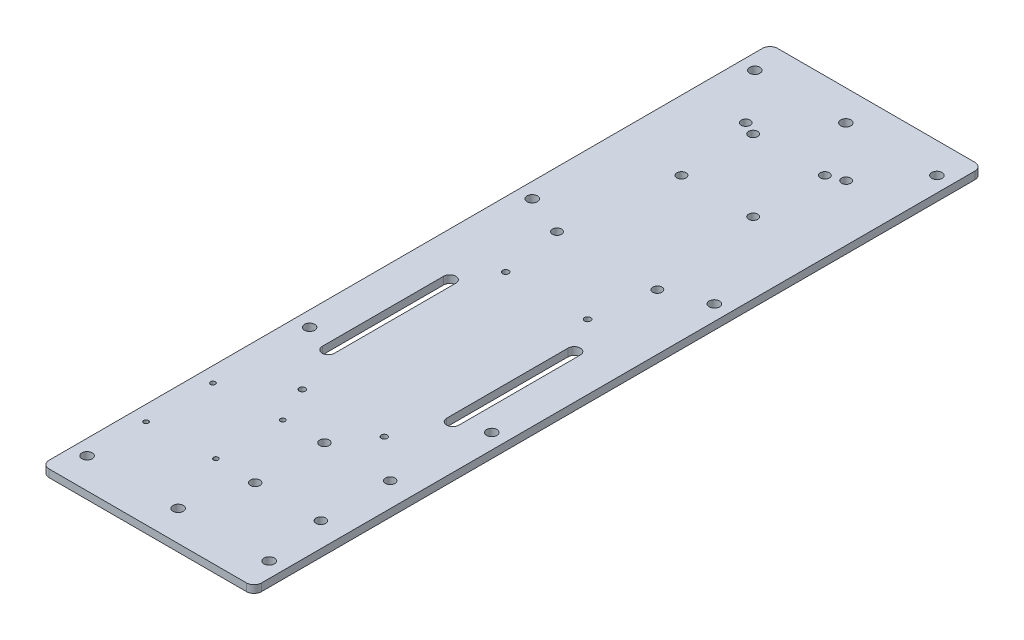
from build123d import *

# Parameters (mm, degrees)
PLATE_THICKNESS_DEPTH        = 3.175
SKETCH3_R                    = 2.159
MOUNTING_HOLES_DEPTH         = 159.781746826
SKETCH4_R                    = 1.905
JETSON_HOLES_W_O_MOUNT_DEPTH = 159.781746826
SKETCH5_R                    = 1.905
PDB_HOLES_DEPTH              = 159.781746826
SKETCH7_R                    = 1.27
PIXHAWK_HOLES_DEPTH          = 159.781746826
BATTERY_HOLES_DEPTH          = 159.781746826
SKETCH9_R                    = 2
CUT_EXTRUDE1_DEPTH           = 159.781746826
VENTRAL_CAMERA_HOLES_REACH   = 160.782
SKETCH10_R                   = 1


with BuildPart() as part:
    # Sketch2 → Plate Thickness (new body)
    with BuildSketch(Plane(origin=(0, 0, 0), x_dir=(1, 0, 0), z_dir=(0, 1, 0))):
        with BuildLine():
            Line((-41.275, 152.4), (41.275, 152.4))
            ThreePointArc((41.275, 152.4), (43.52006403, 151.47006403), (44.45, 149.225))
            Line((44.45, 149.225), (44.45, -149.225))
            ThreePointArc((44.45, -149.225), (43.52006403, -151.47006403), (41.275, -152.4))
            Line((41.275, -152.4), (-41.275, -152.4))
            ThreePointArc((-41.275, -152.4), (-43.52006403, -151.47006403), (-44.45, -149.225))
            Line((-44.45, -149.225), (-44.45, 149.225))
            ThreePointArc((-44.45, 149.225), (-43.52006403, 151.47006403), (-41.275, 152.4))
        make_face()
    extrude(amount=PLATE_THICKNESS_DEPTH)

    # Sketch3 → Mounting holes (cut, through all)
    with BuildSketch(Plane(origin=(0, 3.175, 0), x_dir=(1, 0, 0), z_dir=(0, 1, 0))):
        with Locations(Location((-38.1, 139.7, 0), (0, 0, 270))):
            Circle(SKETCH3_R)
        with Locations(Location((-38.1, 46.566666666, 0), (0, 0, 270))):
            Circle(SKETCH3_R)
        with Locations(Location((-38.1, -46.56666582, 0), (0, 0, 90))):
            Circle(SKETCH3_R)
        with Locations(Location((-38.1, -139.7, 0), (0, 0, 90))):
            Circle(SKETCH3_R)
        with Locations(Location((38.1, -139.7, 0), (0, 0, 270))):
            Circle(SKETCH3_R)
        with Locations(Location((38.1, -46.56666582, 0), (0, 0, 270))):
            Circle(SKETCH3_R)
        with Locations(Location((38.1, 46.566666666, 0), (0, 0, 90))):
            Circle(SKETCH3_R)
        with Locations(Location((38.1, 139.7, 0), (0, 0, 90))):
            Circle(SKETCH3_R)
        with Locations(Location((0, 139.7, 0), (0, 0, 270))):
            Circle(SKETCH3_R)
        with Locations(Location((0, -139.7, 0), (0, 0, 90))):
            Circle(SKETCH3_R)
    extrude(amount=-MOUNTING_HOLES_DEPTH, mode=Mode.SUBTRACT)

    # Sketch4 → Jetson Holes (w/o mount) (cut, through all)
    with BuildSketch(Plane(origin=(0, 3.175, 0), x_dir=(1, 0, 0), z_dir=(0, 1, 0))):
        with Locations(Location((-21.0058, 118.808268359, 0), (0, 0, 270))):
            Circle(SKETCH4_R)
        with Locations(Location((-21.0058, 39.814268359, 0), (0, 0, 270))):
            Circle(SKETCH4_R)
        with Locations(Location((21.0058, 39.814268359, 0), (0, 0, 90))):
            Circle(SKETCH4_R)
        with Locations(Location((21.0058, 118.808268359, 0), (0, 0, 90))):
            Circle(SKETCH4_R)
    extrude(amount=-JETSON_HOLES_W_O_MOUNT_DEPTH, mode=Mode.SUBTRACT)

    # Sketch5 → PDB holes (cut, through all)
    with BuildSketch(Plane(origin=(0, 3.175, 0), x_dir=(1, 0, 0), z_dir=(0, 1, 0))):
        with Locations(Location((-15.378405846, 116.28393812, 0), (0, 0, 270))):
            Circle(SKETCH5_R)
        with Locations(Location((14.618994154, 116.28393812, 0), (0, 0, 270))):
            Circle(SKETCH5_R)
        with Locations(Location((14.618994154, 86.28653812, 0), (0, 0, 270))):
            Circle(SKETCH5_R)
        with Locations(Location((-15.378405846, 86.28653812, 0), (0, 0, 270))):
            Circle(SKETCH5_R)
    extrude(amount=-PDB_HOLES_DEPTH, mode=Mode.SUBTRACT)

    # Sketch7 → PixHawk Holes (cut, through all)
    with BuildSketch(Plane(origin=(0, 3.175, 0), x_dir=(1, 0, 0), z_dir=(0, 1, 0))):
        with Locations(Location((-17.145, 14.489268954, 0), (0, 0, 270))):
            Circle(SKETCH7_R)
        with Locations(Location((-17.145, -70.600731046, 0), (0, 0, 270))):
            Circle(SKETCH7_R)
        with Locations(Location((17.145, -70.600731046, 0), (0, 0, 270))):
            Circle(SKETCH7_R)
        with Locations(Location((17.145, 14.489268954, 0), (0, 0, 270))):
            Circle(SKETCH7_R)
    extrude(amount=-PIXHAWK_HOLES_DEPTH, mode=Mode.SUBTRACT)

    # Sketch8 → Battery Holes (cut, through all)
    with BuildSketch(Plane(origin=(0, 3.175, 0), x_dir=(1, 0, 0), z_dir=(0, 1, 0))):
        with BuildLine():
            Line((-23.495, -0.005964701), (-23.495, -50.805964701))
            ThreePointArc((-23.495, -50.805964701), (-26.035, -53.345964701), (-28.575, -50.805964701))
            Line((-28.575, -50.805964701), (-28.575, -0.005964701))
            ThreePointArc((-28.575, -0.005964701), (-26.035, 2.534035299), (-23.495, -0.005964701))
        make_face()
        with BuildLine():
            Line((23.495, -0.005964701), (23.495, -50.805964701))
            ThreePointArc((23.495, -50.805964701), (26.035, -53.345964701), (28.575, -50.805964701))
            Line((28.575, -50.805964701), (28.575, -0.005964701))
            ThreePointArc((28.575, -0.005964701), (26.035, 2.534035299), (23.495, -0.005964701))
        make_face()
    extrude(amount=-BATTERY_HOLES_DEPTH, mode=Mode.SUBTRACT)

    # Sketch9 → Cut-Extrude1 (cut, through all)
    with BuildSketch(Plane(origin=(0, 3.175, 0), x_dir=(1, 0, 0), z_dir=(0, 1, 0))):
        with Locations(Location((6.833401633, -85.3, 0), (0, 0, 270))):
            Circle(SKETCH9_R)
        with Locations(Location((34.333401633, -85.3, 0), (0, 0, 270))):
            Circle(SKETCH9_R)
        with Locations(Location((34.333401633, -114.3, 0), (0, 0, 270))):
            Circle(SKETCH9_R)
        with Locations(Location((6.833401633, -114.3, 0), (0, 0, 270))):
            Circle(SKETCH9_R)
    extrude(amount=-CUT_EXTRUDE1_DEPTH, mode=Mode.SUBTRACT)

    # Sketch10 → Ventral Camera holes (cut, up to next)
    with BuildSketch(Plane(origin=(0, 3.175, 0), x_dir=(1, 0, 0), z_dir=(0, 1, 0)), mode=Mode.PRIVATE) as ventral_camera_holes_sk1:
        with Locations(Location((-38.125460092, -87.008641581, 0), (0, 0, 270))):
            Circle(SKETCH10_R)
    ventral_camera_holes_tool1 = extrude(ventral_camera_holes_sk1.sketch, amount=-VENTRAL_CAMERA_HOLES_REACH, mode=Mode.PRIVATE) & part.part
    # Sketch10 → Ventral Camera holes (cut, up to next)
    with BuildSketch(Plane(origin=(0, 3.175, 0), x_dir=(1, 0, 0), z_dir=(0, 1, 0)), mode=Mode.PRIVATE) as ventral_camera_holes_sk2:
        with Locations(Location((-38.1, -115.008630005, 0), (0, 0, 270))):
            Circle(SKETCH10_R)
    ventral_camera_holes_tool2 = extrude(ventral_camera_holes_sk2.sketch, amount=-VENTRAL_CAMERA_HOLES_REACH, mode=Mode.PRIVATE) & part.part
    # Sketch10 → Ventral Camera holes (cut, up to next)
    with BuildSketch(Plane(origin=(0, 3.175, 0), x_dir=(1, 0, 0), z_dir=(0, 1, 0)), mode=Mode.PRIVATE) as ventral_camera_holes_sk3:
        with Locations(Location((-10.126568972, -85.789139736, 0), (0, 0, 270))):
            Circle(SKETCH10_R)
    ventral_camera_holes_tool3 = extrude(ventral_camera_holes_sk3.sketch, amount=-VENTRAL_CAMERA_HOLES_REACH, mode=Mode.PRIVATE) & part.part
    # Sketch10 → Ventral Camera holes (cut, up to next)
    with BuildSketch(Plane(origin=(0, 3.175, 0), x_dir=(1, 0, 0), z_dir=(0, 1, 0)), mode=Mode.PRIVATE) as ventral_camera_holes_sk4:
        with Locations(Location((-10.126568972, -113.789139736, 0), (0, 0, 270))):
            Circle(SKETCH10_R)
    ventral_camera_holes_tool4 = extrude(ventral_camera_holes_sk4.sketch, amount=-VENTRAL_CAMERA_HOLES_REACH, mode=Mode.PRIVATE) & part.part
    add(ventral_camera_holes_tool1.solids().sort_by_distance((-38.12546, 3.175, 87.008642))[0], mode=Mode.SUBTRACT)
    add(ventral_camera_holes_tool2.solids().sort_by_distance((-38.1, 3.175, 115.00863))[0], mode=Mode.SUBTRACT)
    add(ventral_camera_holes_tool3.solids().sort_by_distance((-10.126569, 3.175, 85.78914))[0], mode=Mode.SUBTRACT)
    add(ventral_camera_holes_tool4.solids().sort_by_distance((-10.126569, 3.175, 113.78914))[0], mode=Mode.SUBTRACT)


solid = part.part
